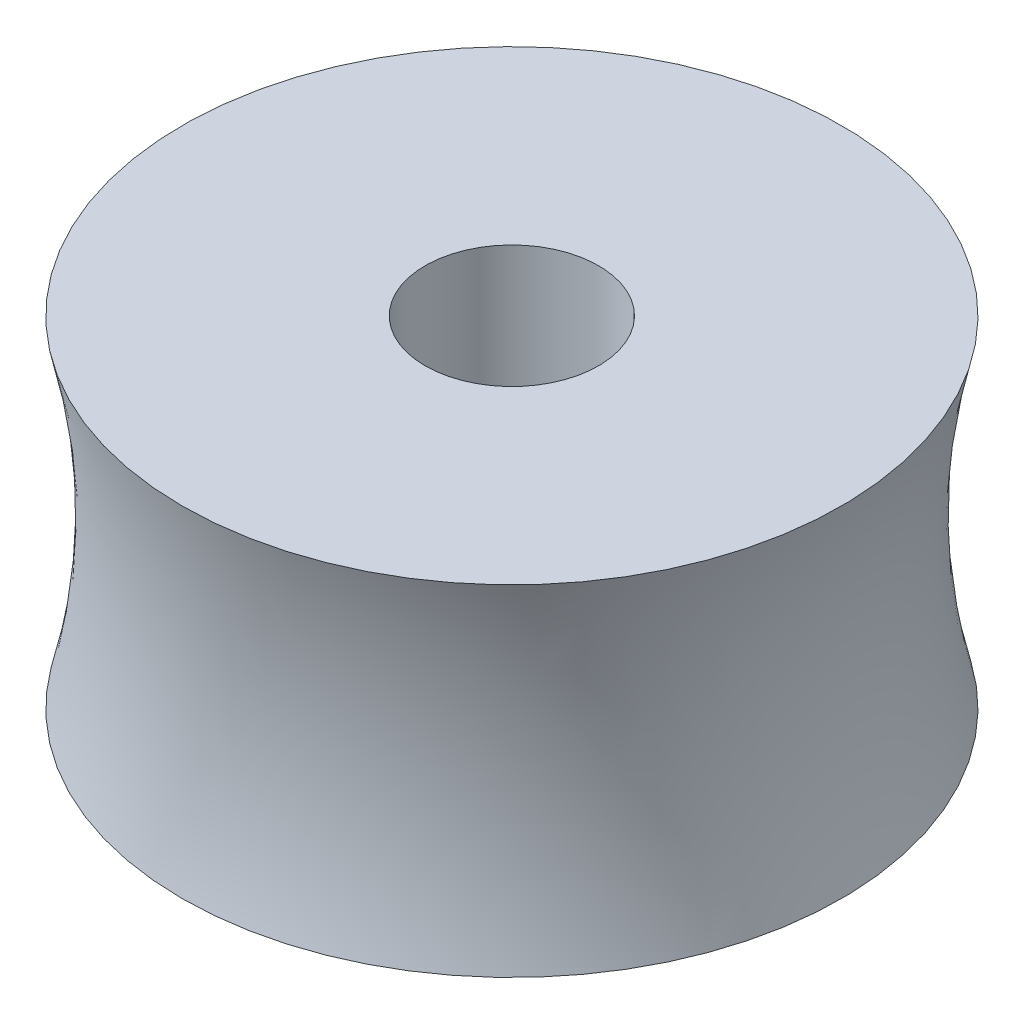
from build123d import *


with BuildPart() as part:
    # Sketch1 → Revolve1 (revolve)
    with BuildSketch(Plane(origin=(0, 0, 0), x_dir=(0, 0, -1), z_dir=(1, 0, 0)), mode=Mode.PRIVATE) as revolve1_sk:
        with BuildLine():
            Line((2.5, 0), (2.5, -9.8))
            Line((2.5, -9.8), (9.5, -9.8))
            ThreePointArc((9.5, -9.8), (8.890461573, -4.9), (9.5, 0))
            Line((9.5, 0), (2.5, 0))
        make_face()
    revolve(revolve1_sk.sketch.rotate(Axis((0, 0, 0), (0, -1, 0)), 180), axis=Axis((0, 0, 0), (0, -1, 0)))


solid = part.part
